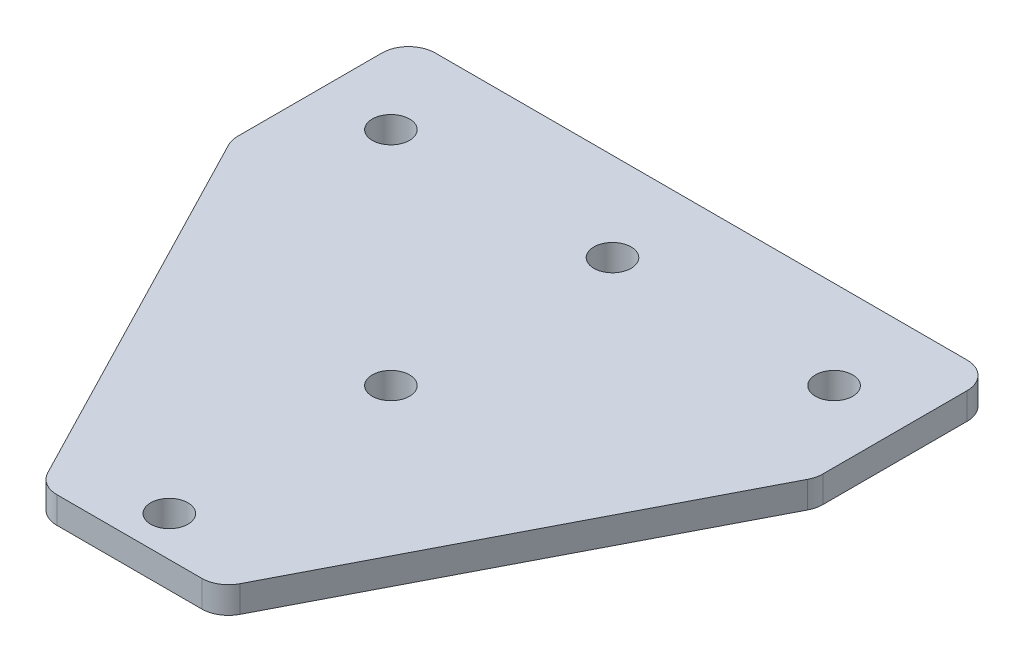
from build123d import *

# Parameters (mm, degrees)
SKETCH_1_R      = 2.1
EXTRUDE_1_DEPTH = 3
FILLET_1_R      = 3


with BuildPart() as part:
    # 草图1 → 凸台-拉伸1 (new body)
    with BuildSketch(Plane(origin=(0, 0, 0), x_dir=(1, 0, 0), z_dir=(0, 1, 0))):
        Polygon((33, 10), (-33, 10), (-33, -10), (-10, -54.5), (10, -54.5), (33, -10), align=None)
        with Locations(Location((0, 0, 0), (0, 0, 270))):
            Circle(SKETCH_1_R, mode=Mode.SUBTRACT)
        with Locations(Location((25, 0, 0), (0, 0, 270))):
            Circle(SKETCH_1_R, mode=Mode.SUBTRACT)
        with Locations(Location((-25, 0, 0), (0, 0, 270))):
            Circle(SKETCH_1_R, mode=Mode.SUBTRACT)
        with Locations(Location((0, -25, 0), (0, 0, 270))):
            Circle(SKETCH_1_R, mode=Mode.SUBTRACT)
        with Locations(Location((0, -50, 0), (0, 0, 270))):
            Circle(SKETCH_1_R, mode=Mode.SUBTRACT)
    extrude(amount=EXTRUDE_1_DEPTH)

    # 圆角1
    fillet_1_edges = [part.edges().sort_by_distance(p)[0] for p in [
        (10, 1.5, 54.5),
        (-10, 1.5, 54.5),
        (-33, 1.5, 10),
        (-33, 1.5, -10),
        (33, 1.5, -10),
        (33, 1.5, 10),
    ]]
    fillet(fillet_1_edges, radius=FILLET_1_R)


solid = part.part
